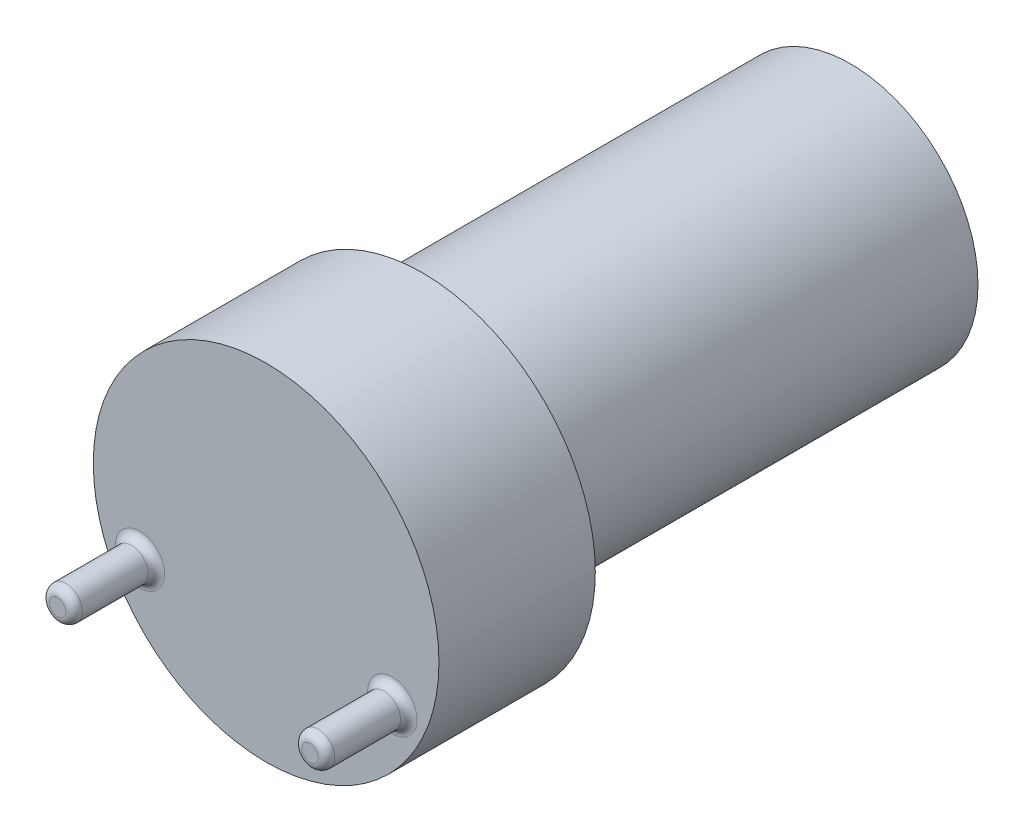
from build123d import *

# Parameters (mm, degrees)
SKETCH1_R           = 15.5
BOSS_EXTRUDE1_DEPTH = 52
SKETCH2_R           = 21
BOSS_EXTRUDE2_DEPTH = 19
SKETCH3_R           = 2
BOSS_EXTRUDE3_DEPTH = 10
FILLET1_R           = 1


with BuildPart() as part:
    # Sketch1 → Boss-Extrude1 (new body)
    with BuildSketch(Plane.XY):
        with Locations(Location((0, 0, 0), (0, 0, 180))):
            Circle(SKETCH1_R)
    extrude(amount=BOSS_EXTRUDE1_DEPTH)

    # Sketch2 → Boss-Extrude2 (add)
    with BuildSketch(Plane.XY.offset(52)):
        with Locations((0, -1.5)):
            Circle(SKETCH2_R)
    extrude(amount=BOSS_EXTRUDE2_DEPTH)

    # Sketch3 → Boss-Extrude3 (add)
    with BuildSketch(Plane.XY.offset(71)):
        with Locations((-15.337121903, -8.854891459)):
            Circle(SKETCH3_R)
        with Locations(Location((15.337121903, -8.854891459, 0), (0, 0, 180))):
            Circle(SKETCH3_R)
    extrude(amount=BOSS_EXTRUDE3_DEPTH)

    # Fillet1
    fillet1_edges = [part.edges().sort_by_distance(p)[0] for p in [
        (-17.337121903, -8.854891459, 71),
        (-17.337121903, -8.854891459, 81),
        (17.337121903, -8.854891459, 71),
        (17.337121903, -8.854891459, 81),
    ]]
    fillet(fillet1_edges, radius=FILLET1_R)


solid = part.part
